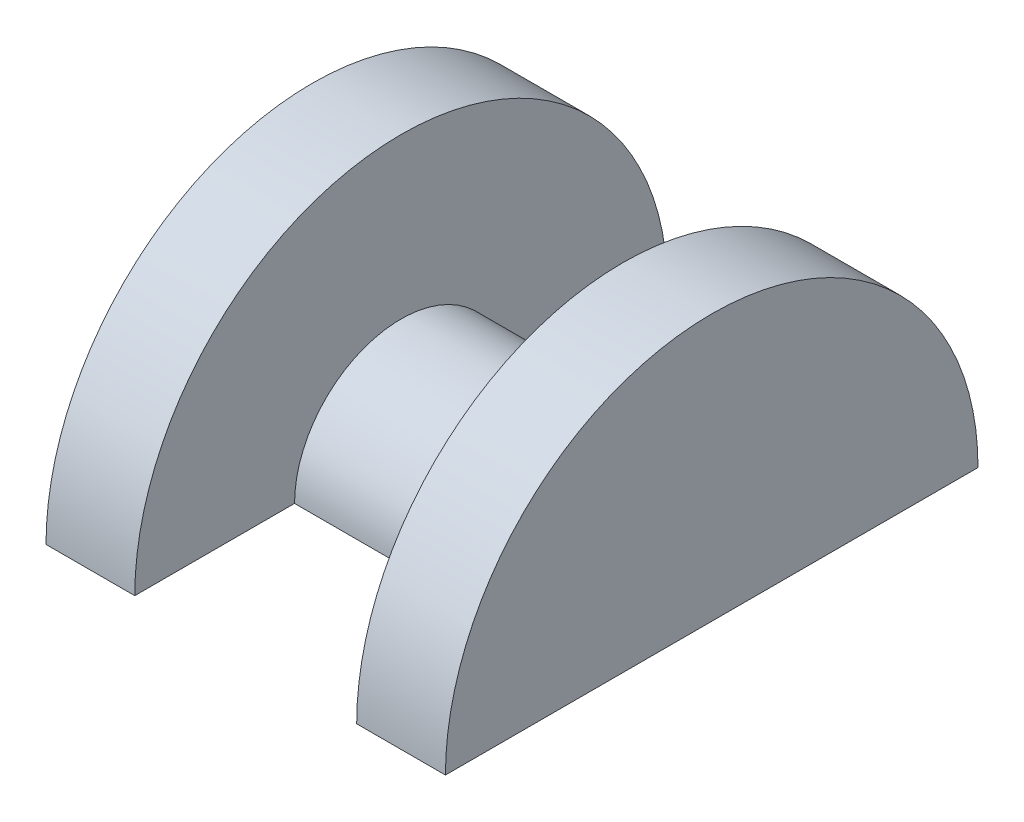
from build123d import *

# Parameters (mm, degrees)
BOSS_EXTRUDE1_DEPTH = 1
BOSS_EXTRUDE2_DEPTH = 1.25


with BuildPart() as part:
    # Sketch1 → Boss-Extrude1 (new body)
    with BuildSketch(Plane(origin=(0, 0, 0), x_dir=(0, 0, -1), z_dir=(1, 0, 0))):
        with BuildLine():
            ThreePointArc((3, 0), (0, 3), (-3, 0))
            Line((-3, 0), (3, 0))
        make_face()
    extrude(amount=BOSS_EXTRUDE1_DEPTH)

    # Sketch1<3> → Boss-Extrude2 (add)
    with BuildSketch(Plane(origin=(0, 0, 0), x_dir=(0, 0, -1), z_dir=(1, 0, 0))):
        with BuildLine():
            ThreePointArc((1.2, 0), (0, 1.2), (-1.2, 0))
            Line((-1.2, 0), (1.2, 0))
        make_face()
    extrude(amount=-BOSS_EXTRUDE2_DEPTH)

    # Mirror1: part across plane


with BuildPart() as part_1:
    add(part.part)
    add(part.part.mirror(Plane.ZY.offset(1.25)))


solid = part_1.part
